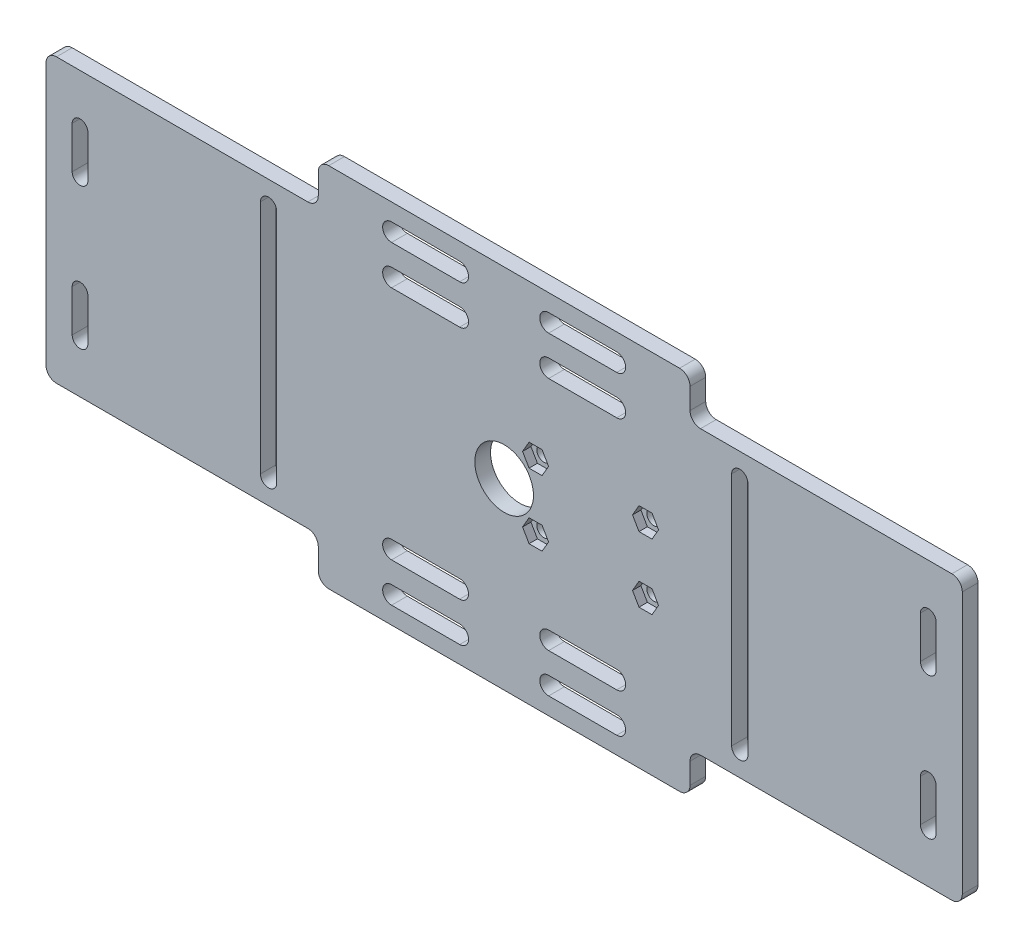
from build123d import *
from OCP.BRepFilletAPI import BRepFilletAPI_MakeChamfer

# Parameters (mm, degrees)
EXTRUDE_1_DEPTH     = 3
SKETCH_2_R          = 5.6
SKETCH_2_R_2        = 1.35
CUT_EXTRUDE_1_DEPTH = 95.288122264
CUT_EXTRUDE_2_DEPTH = 1.6
SKETCH_4_R          = 2.1
SKETCH_4_R_2        = 1.35
SKETCH_4_R_3        = 2
SKETCH_4_R_4        = 1.25
EXTRUDE_2_DEPTH     = 2
CHAMFER_1_SIZE      = 0.5
CHAMFER_1_SIZE2     = 0.288675135
FILLET_2_R          = 0.5


with BuildPart() as part:
    # 草圖1 → 填料-伸長1 (new body)
    with BuildSketch(Plane.XY):
        with BuildLine():
            Line((35.5, 33), (35.5, 29))
            ThreePointArc((35.5, 29), (36.085786438, 27.585786438), (37.5, 27))
            Line((37.5, 27), (85.5, 27))
            ThreePointArc((85.5, 27), (86.914213562, 26.414213562), (87.5, 25))
            Line((87.5, 25), (87.5, -25))
            ThreePointArc((87.5, -25), (86.914213562, -26.414213562), (85.5, -27))
            Line((85.5, -27), (37.5, -27))
            ThreePointArc((37.5, -27), (36.085786438, -27.585786438), (35.5, -29))
            Line((35.5, -29), (35.5, -33))
            ThreePointArc((35.5, -33), (34.914213562, -34.414213562), (33.5, -35))
            Line((33.5, -35), (-33.5, -35))
            ThreePointArc((-33.5, -35), (-34.914213562, -34.414213562), (-35.5, -33))
            Line((-35.5, -33), (-35.5, -29))
            ThreePointArc((-35.5, -29), (-36.085786438, -27.585786438), (-37.5, -27))
            Line((-37.5, -27), (-85.5, -27))
            ThreePointArc((-85.5, -27), (-86.914213562, -26.414213562), (-87.5, -25))
            Line((-87.5, -25), (-87.5, 25))
            ThreePointArc((-87.5, 25), (-86.914213562, 26.414213562), (-85.5, 27))
            Line((-85.5, 27), (-37.5, 27))
            ThreePointArc((-37.5, 27), (-36.085786438, 27.585786438), (-35.5, 29))
            Line((-35.5, 29), (-35.5, 33))
            ThreePointArc((-35.5, 33), (-34.914213562, 34.414213562), (-33.5, 35))
            Line((-33.5, 35), (33.5, 35))
            ThreePointArc((33.5, 35), (34.914213562, 34.414213562), (35.5, 33))
        make_face()
    extrude(amount=EXTRUDE_1_DEPTH)

    # 草圖2 → 除料-伸長1 (cut, through all)
    with BuildSketch(Plane.XY.offset(3)):
        Circle(SKETCH_2_R)
        with Locations((27, 6.25)):
            Circle(SKETCH_2_R_2)
        with Locations((6, 6.25)):
            Circle(SKETCH_2_R_2)
        with Locations((6, -6.25)):
            Circle(SKETCH_2_R_2)
        with Locations((27, -6.25)):
            Circle(SKETCH_2_R_2)
        with BuildLine():
            Line((43.45, -22.5), (43.45, 22.5))
            ThreePointArc((43.45, 22.5), (45, 24.05), (46.55, 22.5))
            Line((46.55, 22.5), (46.55, -22.5))
            ThreePointArc((46.55, -22.5), (45, -24.05), (43.45, -22.5))
        make_face()
        with BuildLine():
            Line((-46.55, -22.5), (-46.55, 22.5))
            ThreePointArc((-46.55, 22.5), (-45, 24.05), (-43.45, 22.5))
            Line((-43.45, 22.5), (-43.45, -22.5))
            ThreePointArc((-43.45, -22.5), (-45, -24.05), (-46.55, -22.5))
        make_face()
        with BuildLine():
            Line((21.5, -31.7), (8.5, -31.7))
            ThreePointArc((8.5, -31.7), (6.8, -30), (8.5, -28.3))
            Line((8.5, -28.3), (21.5, -28.3))
            ThreePointArc((21.5, -28.3), (23.2, -30), (21.5, -31.7))
        make_face()
        with BuildLine():
            Line((-21.5, -31.7), (-8.5, -31.7))
            ThreePointArc((-8.5, -31.7), (-6.8, -30), (-8.5, -28.3))
            Line((-8.5, -28.3), (-21.5, -28.3))
            ThreePointArc((-21.5, -28.3), (-23.2, -30), (-21.5, -31.7))
        make_face()
        with BuildLine():
            Line((21.5, 31.7), (8.5, 31.7))
            ThreePointArc((8.5, 31.7), (6.8, 30), (8.5, 28.3))
            Line((8.5, 28.3), (21.5, 28.3))
            ThreePointArc((21.5, 28.3), (23.2, 30), (21.5, 31.7))
        make_face()
        with BuildLine():
            Line((-21.5, 31.7), (-8.5, 31.7))
            ThreePointArc((-8.5, 31.7), (-6.8, 30), (-8.5, 28.3))
            Line((-8.5, 28.3), (-21.5, 28.3))
            ThreePointArc((-21.5, 28.3), (-23.2, 30), (-21.5, 31.7))
        make_face()
        with BuildLine():
            Line((21.5, 24.2), (8.5, 24.2))
            ThreePointArc((8.5, 24.2), (6.8, 22.5), (8.5, 20.8))
            Line((8.5, 20.8), (21.5, 20.8))
            ThreePointArc((21.5, 20.8), (23.2, 22.5), (21.5, 24.2))
        make_face()
        with BuildLine():
            Line((-21.5, 24.2), (-8.5, 24.2))
            ThreePointArc((-8.5, 24.2), (-6.8, 22.5), (-8.5, 20.8))
            Line((-8.5, 20.8), (-21.5, 20.8))
            ThreePointArc((-21.5, 20.8), (-23.2, 22.5), (-21.5, 24.2))
        make_face()
        with BuildLine():
            Line((-21.5, -24.2), (-8.5, -24.2))
            ThreePointArc((-8.5, -24.2), (-6.8, -22.5), (-8.5, -20.8))
            Line((-8.5, -20.8), (-21.5, -20.8))
            ThreePointArc((-21.5, -20.8), (-23.2, -22.5), (-21.5, -24.2))
        make_face()
        with BuildLine():
            Line((21.5, -24.2), (8.5, -24.2))
            ThreePointArc((8.5, -24.2), (6.8, -22.5), (8.5, -20.8))
            Line((8.5, -20.8), (21.5, -20.8))
            ThreePointArc((21.5, -20.8), (23.2, -22.5), (21.5, -24.2))
        make_face()
        with BuildLine():
            Line((-82.5, -17.5), (-82.5, -9.5))
            ThreePointArc((-82.5, -9.5), (-81, -8), (-79.5, -9.5))
            Line((-79.5, -9.5), (-79.5, -17.5))
            ThreePointArc((-79.5, -17.5), (-81, -19), (-82.5, -17.5))
        make_face()
        with BuildLine():
            Line((-82.5, 17.5), (-82.5, 9.5))
            ThreePointArc((-82.5, 9.5), (-81, 8), (-79.5, 9.5))
            Line((-79.5, 9.5), (-79.5, 17.5))
            ThreePointArc((-79.5, 17.5), (-81, 19), (-82.5, 17.5))
        make_face()
        with BuildLine():
            Line((79.5, -17.5), (79.5, -9.5))
            ThreePointArc((79.5, -9.5), (81, -8), (82.5, -9.5))
            Line((82.5, -9.5), (82.5, -17.5))
            ThreePointArc((82.5, -17.5), (81, -19), (79.5, -17.5))
        make_face()
        with BuildLine():
            Line((79.5, 17.5), (79.5, 9.5))
            ThreePointArc((79.5, 9.5), (81, 8), (82.5, 9.5))
            Line((82.5, 9.5), (82.5, 17.5))
            ThreePointArc((82.5, 17.5), (81, 19), (79.5, 17.5))
        make_face()
    extrude(amount=-CUT_EXTRUDE_1_DEPTH, mode=Mode.SUBTRACT)

    # 草圖3 → 除料-伸長2 (cut)
    with BuildSketch(Plane.XY.offset(3)):
        Polygon((29.482606158, -6.25), (28.241303079, -4.1), (25.758696921, -4.1), (24.517393842, -6.25), (25.758696921, -8.4), (28.241303079, -8.4), align=None)
        Polygon((8.482606158, -6.25), (7.241303079, -4.1), (4.758696921, -4.1), (3.517393842, -6.25), (4.758696921, -8.4), (7.241303079, -8.4), align=None)
        Polygon((29.482606158, 6.25), (28.241303079, 8.4), (25.758696921, 8.4), (24.517393842, 6.25), (25.758696921, 4.1), (28.241303079, 4.1), align=None)
        Polygon((8.482606158, 6.25), (7.241303079, 8.4), (4.758696921, 8.4), (3.517393842, 6.25), (4.758696921, 4.1), (7.241303079, 4.1), align=None)
    extrude(amount=-CUT_EXTRUDE_2_DEPTH, mode=Mode.SUBTRACT)

    # 草圖4 → 填料-伸長2 (add)
    # profile 1 of 4: a face of its own
    with BuildSketch(Plane(origin=(0, 0, 0), x_dir=(-1, 0, 0), z_dir=(0, 0, -1))):
        with Locations(Location((-27, 6.25, 0), (0, 0, 180))):
            Circle(SKETCH_4_R)
        with Locations(Location((-27, 6.25, 0), (0, 0, 180))):
            Circle(SKETCH_4_R_2, mode=Mode.SUBTRACT)
    # profile 2 of 4: a face of its own
    with BuildSketch(Plane(origin=(0, 0, 0), x_dir=(-1, 0, 0), z_dir=(0, 0, -1))):
        with Locations(Location((-27, -6.25, 0), (0, 0, 180))):
            Circle(SKETCH_4_R_3)
        with Locations((-27, -6.25)):
            Circle(SKETCH_4_R_4, mode=Mode.SUBTRACT)
    # profile 3 of 4: a face of its own
    with BuildSketch(Plane(origin=(0, 0, 0), x_dir=(-1, 0, 0), z_dir=(0, 0, -1))):
        with Locations(Location((-6, 6.25, 0), (0, 0, 180))):
            Circle(SKETCH_4_R_3)
        with Locations((-6, 6.25)):
            Circle(SKETCH_4_R_4, mode=Mode.SUBTRACT)
    # profile 4 of 4: a face of its own
    with BuildSketch(Plane(origin=(0, 0, 0), x_dir=(-1, 0, 0), z_dir=(0, 0, -1))):
        with Locations(Location((-6, -6.25, 0), (0, 0, 180))):
            Circle(SKETCH_4_R_3)
        with Locations((-6, -6.25)):
            Circle(SKETCH_4_R_4, mode=Mode.SUBTRACT)
    extrude(amount=EXTRUDE_2_DEPTH)

    # 導角1: one chamfer whose edges measure the first distance from different faces: ONE call of the kernel's chamfer builder (chamfer() names one face for all edges)
    chamfer_1_edges_1 = [part.edges().sort_by_distance(p)[0] for p in [
        (25.65, 6.25, -2),
    ]]
    chamfer_1_side_1 = [part.faces().sort_by_distance(p)[0] for p in [
        (24.95939697, 6.25, -2),
    ]]
    chamfer_1_edges_2 = [part.edges().sort_by_distance(p)[0] for p in [
        (28.25, -6.25, -2),
    ]]
    chamfer_1_side_2 = [part.faces().sort_by_distance(p)[0] for p in [
        (25.056568542, -6.25, -2),
    ]]
    chamfer_1_edges_3 = [part.edges().sort_by_distance(p)[0] for p in [
        (7.25, 6.25, -2),
    ]]
    chamfer_1_side_3 = [part.faces().sort_by_distance(p)[0] for p in [
        (4.056568542, 6.25, -2),
    ]]
    chamfer_1_edges_4 = [part.edges().sort_by_distance(p)[0] for p in [
        (7.25, -6.25, -2),
    ]]
    chamfer_1_side_4 = [part.faces().sort_by_distance(p)[0] for p in [
        (4.056568542, -6.25, -2),
    ]]
    chamfer_1 = BRepFilletAPI_MakeChamfer(part.part.solid().wrapped)
    for e in chamfer_1_edges_1:
        chamfer_1.Add(CHAMFER_1_SIZE, CHAMFER_1_SIZE2, e.wrapped, chamfer_1_side_1[0].wrapped)  # the first distance lies on this face
    for e in chamfer_1_edges_2:
        chamfer_1.Add(CHAMFER_1_SIZE, CHAMFER_1_SIZE2, e.wrapped, chamfer_1_side_2[0].wrapped)  # the first distance lies on this face
    for e in chamfer_1_edges_3:
        chamfer_1.Add(CHAMFER_1_SIZE, CHAMFER_1_SIZE2, e.wrapped, chamfer_1_side_3[0].wrapped)  # the first distance lies on this face
    for e in chamfer_1_edges_4:
        chamfer_1.Add(CHAMFER_1_SIZE, CHAMFER_1_SIZE2, e.wrapped, chamfer_1_side_4[0].wrapped)  # the first distance lies on this face
    add(Compound.cast(chamfer_1.Shape()), mode=Mode.REPLACE)

    # 圓角2
    fillet_2_edges = [part.edges().sort_by_distance(p)[0] for p in [
        (24.9, 6.25, 0),
        (25, -6.25, 0),
        (4, 6.25, 0),
        (4, -6.25, 0),
    ]]
    fillet(fillet_2_edges, radius=FILLET_2_R)


solid = part.part
